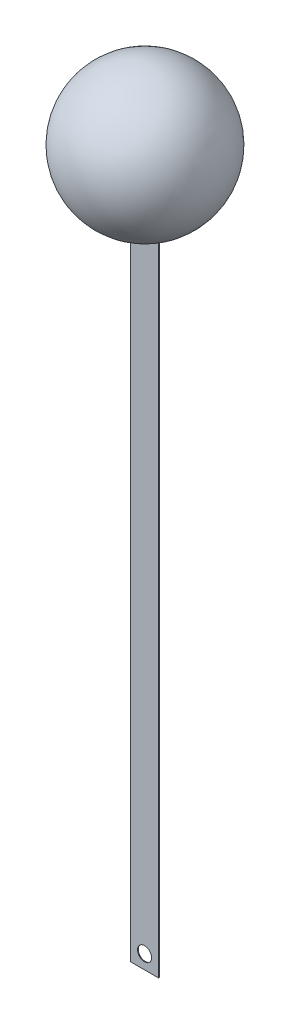
from build123d import *

# Parameters (mm, degrees)
BOSS_EXTRUDE2_REACH      = 566.447
BOSS_EXTRUDE2_END_RADIUS = 50
SKETCH6_W                = 20
SKETCH6_H                = 0.5
CUT_EXTRUDE1_DEPTH       = 565.468832178
CUT_EXTRUDE1_DEPTH_BACK  = 565.468832178
SKETCH7_R                = 5


with BuildPart() as part:
    # Sketch1 one side → Revolve3 (revolve)
    with BuildSketch(Plane.XY):
        with BuildLine():
            ThreePointArc((0, 460), (35.355339059, 474.644660941), (50, 510))
            ThreePointArc((50, 510), (35.355339059, 545.355339059), (0, 560))
            Line((0, 560), (0, 460))
        make_face()
    revolve(axis=Axis((0, 510, 0), (0, -1, 0)))

    # Boss-Extrude2: up to this sphere (the profile starts outside it)
    boss_extrude2_end = Location((0, 510, 0)) * Sphere(BOSS_EXTRUDE2_END_RADIUS, mode=Mode.PRIVATE)
    # Sketch6 → Boss-Extrude2 (add, up to the surface)
    with BuildSketch(Plane(origin=(0, 0, 0), x_dir=(1, 0, 0), z_dir=(0, 1, 0)), mode=Mode.PRIVATE) as boss_extrude2_sk1:
        Rectangle(SKETCH6_W, SKETCH6_H)
    boss_extrude2_tool1 = extrude(boss_extrude2_sk1.sketch, amount=BOSS_EXTRUDE2_REACH, mode=Mode.PRIVATE) - boss_extrude2_end
    add(boss_extrude2_tool1.solids().sort_by_distance((0, 0, 0))[0])

    # Sketch7 → Cut-Extrude1 (cut, two sides: drawn at the far end of the back side and taken through both)
    with BuildSketch(Plane.XY.offset(0.25).offset(-CUT_EXTRUDE1_DEPTH_BACK)):
        with Locations((0, 10)):
            Circle(SKETCH7_R)
    extrude(amount=CUT_EXTRUDE1_DEPTH + CUT_EXTRUDE1_DEPTH_BACK, mode=Mode.SUBTRACT)


solid = part.part
